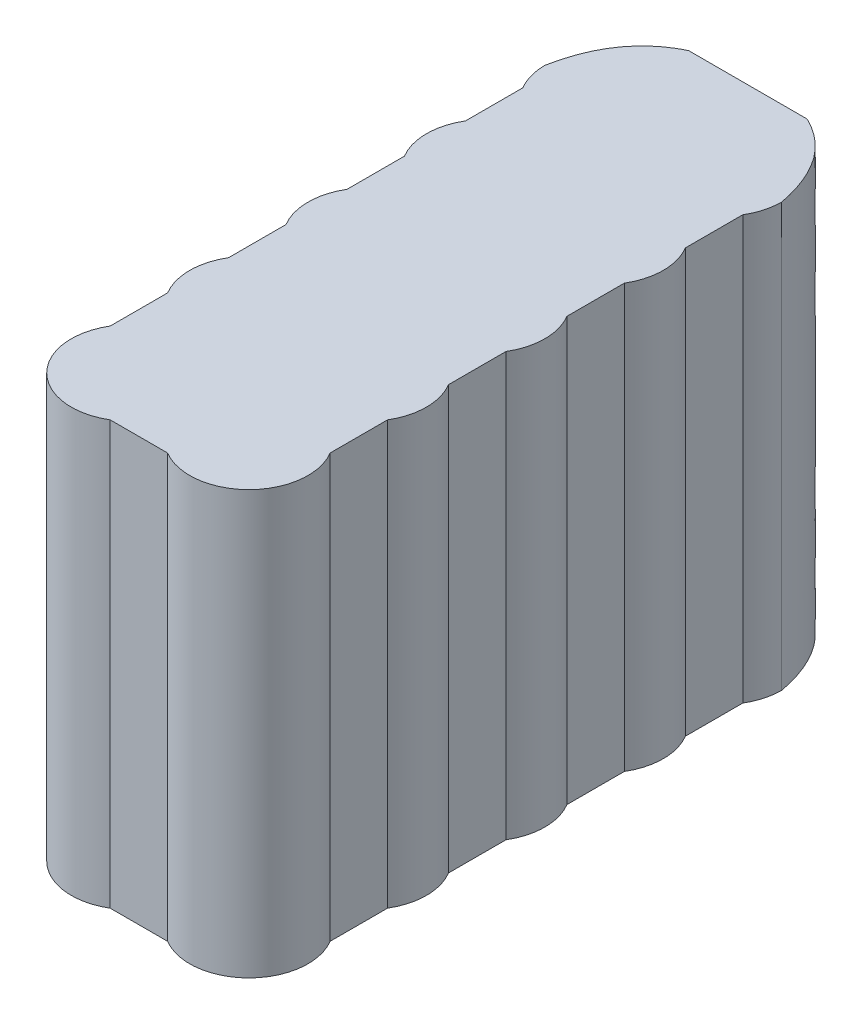
from build123d import *

# Parameters (mm, degrees)
BOSS_EXTRUDE1_DEPTH = 50


with BuildPart() as part:
    # Sketch2 → Boss-Extrude1 (new body)
    with BuildSketch(Plane(origin=(0, 0, 0), x_dir=(1, 0, 0), z_dir=(0, 1, 0))):
        with BuildLine():
            Line((7, 38), (-7, 38))
            add(Edge.make_bspline(
                [(-7, 38), (-12.596418812, 35.328912619), (-14, 28)],
                knots=[0.092966826, 0.092966826, 0.092966826, 0.41073738, 0.41073738, 0.41073738], degree=2))
            ThreePointArc((-14, 28), (-13.745368782, 26.129171307), (-13, 24.394448725))
            Line((-13, 24.394448725), (-13, 17.605551275))
            ThreePointArc((-13, 17.605551275), (-14, 14), (-13, 10.394448725))
            Line((-13, 10.394448725), (-13, 3.605551275))
            ThreePointArc((-13, 3.605551275), (-14, 0), (-13, -3.605551275))
            Line((-13, -3.605551275), (-13, -10.394448725))
            ThreePointArc((-13, -10.394448725), (-14, -14), (-13, -17.605551275))
            Line((-13, -17.605551275), (-13, -24.394448725))
            ThreePointArc((-13, -24.394448725), (-11.949747468, -32.949747468), (-3.394448725, -34))
            Line((-3.394448725, -34), (3.394448725, -34))
            ThreePointArc((3.394448725, -34), (11.949747468, -32.949747468), (13, -24.394448725))
            Line((13, -24.394448725), (13, -17.605551275))
            ThreePointArc((13, -17.605551275), (14, -14), (13, -10.394448725))
            Line((13, -10.394448725), (13, -3.605551275))
            ThreePointArc((13, -3.605551275), (14, 0), (13, 3.605551275))
            Line((13, 3.605551275), (13, 10.394448725))
            ThreePointArc((13, 10.394448725), (14, 14), (13, 17.605551275))
            Line((13, 17.605551275), (13, 24.394448725))
            ThreePointArc((13, 24.394448725), (13.745368782, 26.129171307), (14, 28))
            add(Edge.make_bspline(
                [(14, 28), (12.596418812, 35.328912619), (7, 38)],
                knots=[0.907033174, 0.907033174, 0.907033174, 1.224803727, 1.224803727, 1.224803727], degree=2))
        make_face()
    extrude(amount=BOSS_EXTRUDE1_DEPTH)


solid = part.part
